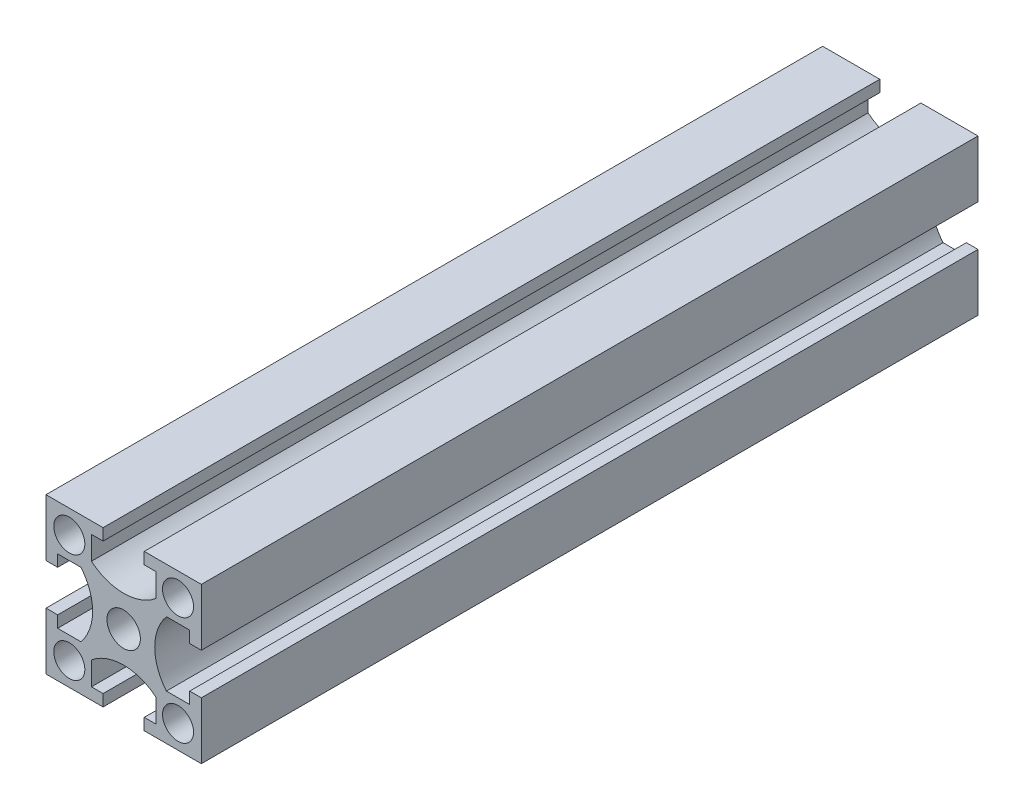
from build123d import *

# Parameters (mm, degrees)
SKETCH_1_W          = 20
SKETCH_1_H          = 20
EXTRUDE_1_DEPTH     = 100
SKETCH_2_R          = 2.15
SKETCH_2_R_2        = 2
CUT_EXTRUDE_1_DEPTH = 101.995049384


with BuildPart() as part:
    # 스케치1 → 보스-돌출1 (new body)
    with BuildSketch(Plane.XY):
        Rectangle(SKETCH_1_W, SKETCH_1_H)
    extrude(amount=EXTRUDE_1_DEPTH)

    # 스케치2 → 컷-돌출1 (cut, through all)
    with BuildSketch(Plane.XY.offset(100)):
        Circle(SKETCH_2_R)
        with Locations((-7, 7)):
            Circle(SKETCH_2_R_2)
        with Locations((7, 7)):
            Circle(SKETCH_2_R_2)
        with Locations((7, -7)):
            Circle(SKETCH_2_R_2)
        with Locations((-7, -7)):
            Circle(SKETCH_2_R_2)
        with BuildLine():
            Line((-2.65, 10), (-2.65, 8.5))
            Line((-2.65, 8.5), (-4.15, 8.5))
            Line((-4.15, 8.5), (-4.15, 5.5))
            ThreePointArc((-4.15, 5.5), (0, 4), (4.15, 5.5))
            Line((4.15, 5.5), (4.15, 8.5))
            Line((4.15, 8.5), (2.65, 8.5))
            Line((2.65, 8.5), (2.65, 10))
            Line((2.65, 10), (-2.65, 10))
        make_face()
        with BuildLine():
            Line((10, 2.65), (8.5, 2.65))
            Line((8.5, 2.65), (8.5, 4.15))
            Line((8.5, 4.15), (5.5, 4.15))
            ThreePointArc((5.5, 4.15), (4, 0), (5.5, -4.15))
            Line((5.5, -4.15), (8.5, -4.15))
            Line((8.5, -4.15), (8.5, -2.65))
            Line((8.5, -2.65), (10, -2.65))
            Line((10, -2.65), (10, 2.65))
        make_face()
        with BuildLine():
            Line((2.65, -10), (2.65, -8.5))
            Line((2.65, -8.5), (4.15, -8.5))
            Line((4.15, -8.5), (4.15, -5.5))
            ThreePointArc((4.15, -5.5), (0, -4), (-4.15, -5.5))
            Line((-4.15, -5.5), (-4.15, -8.5))
            Line((-4.15, -8.5), (-2.65, -8.5))
            Line((-2.65, -8.5), (-2.65, -10))
            Line((-2.65, -10), (2.65, -10))
        make_face()
        with BuildLine():
            Line((-10, -2.65), (-8.5, -2.65))
            Line((-8.5, -2.65), (-8.5, -4.15))
            Line((-8.5, -4.15), (-5.5, -4.15))
            ThreePointArc((-5.5, -4.15), (-4, 0), (-5.5, 4.15))
            Line((-5.5, 4.15), (-8.5, 4.15))
            Line((-8.5, 4.15), (-8.5, 2.65))
            Line((-8.5, 2.65), (-10, 2.65))
            Line((-10, 2.65), (-10, -2.65))
        make_face()
    extrude(amount=-CUT_EXTRUDE_1_DEPTH, mode=Mode.SUBTRACT)


solid = part.part
